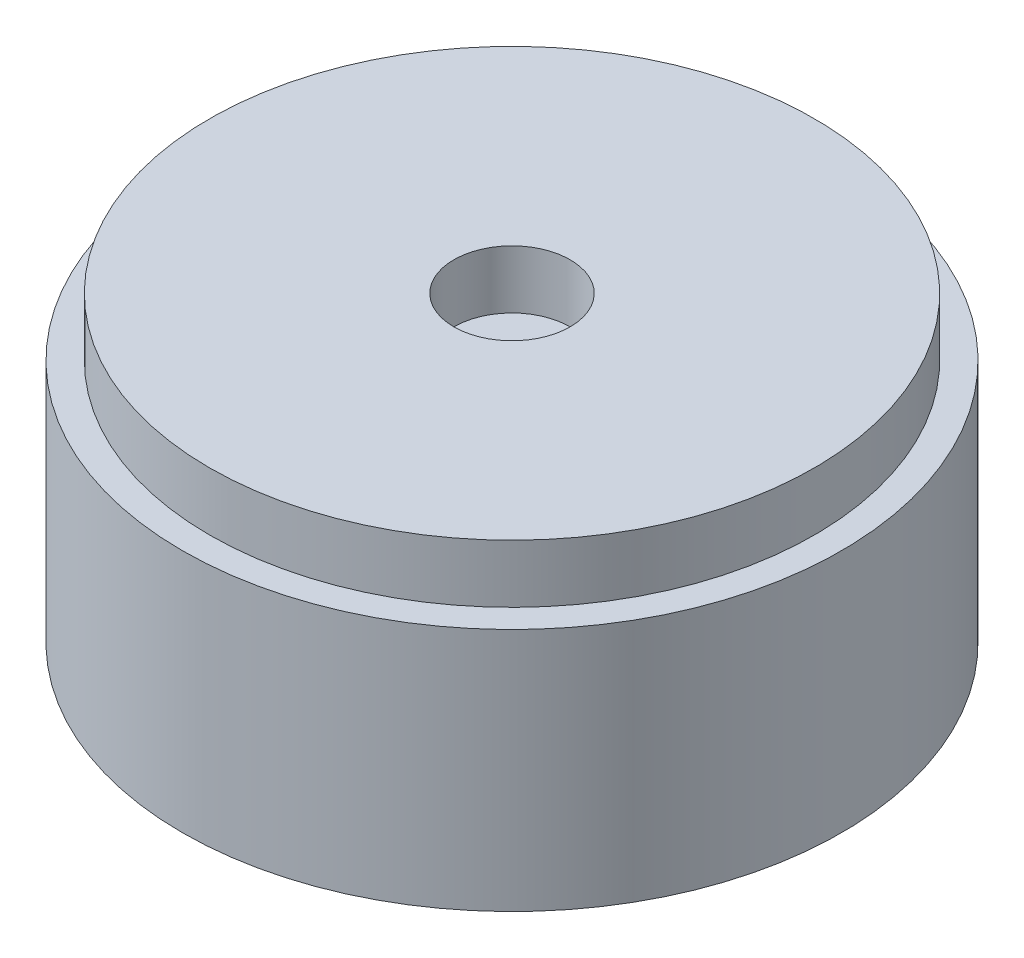
from build123d import *
from OCP.BRepFilletAPI import BRepFilletAPI_MakeChamfer

# Parameters (mm, degrees)
SKETCH1_R           = 8.5
BOSS_EXTRUDE1_DEPTH = 7.8
CUT_EXTRUDE1_START  = -1.5
SKETCH2_R           = 8.5
SKETCH2_R_2         = 7.8
SKETCH2_R_3         = 1.5
CUT_EXTRUDE1_DEPTH  = 1.5
SKETCH3_R           = 0.5
BOSS_EXTRUDE2_DEPTH = 2
CHAMFER1_SIZE       = 0.5
CHAMFER1_SIZE2      = 0.1
FILLET1_R           = 1


with BuildPart() as part:
    # Sketch1 → Boss-Extrude1 (new body)
    with BuildSketch(Plane(origin=(0, 0, 0), x_dir=(1, 0, 0), z_dir=(0, 1, 0))):
        with Locations(Location((0, 0, 0), (0, 0, 270))):
            Circle(SKETCH1_R)
    extrude(amount=BOSS_EXTRUDE1_DEPTH)

    # Sketch2 → Cut-Extrude1 (cut)
    # profile 1 of 2: a face of its own
    with BuildSketch(Plane(origin=(0, 7.8, 0), x_dir=(1, 0, 0), z_dir=(0, 1, 0)).offset(CUT_EXTRUDE1_START)):
        with Locations(Location((0, 0, 0), (0, 0, 270))):
            Circle(SKETCH2_R)
        with Locations(Location((0, 0, 0), (0, 0, 270))):
            Circle(SKETCH2_R_2, mode=Mode.SUBTRACT)
    # profile 2 of 2: a face of its own
    with BuildSketch(Plane(origin=(0, 7.8, 0), x_dir=(1, 0, 0), z_dir=(0, 1, 0)).offset(CUT_EXTRUDE1_START)):
        with Locations(Location((0, 0, 0), (0, 0, 270))):
            Circle(SKETCH2_R_3)
    extrude(amount=CUT_EXTRUDE1_DEPTH, mode=Mode.SUBTRACT)

    # Sketch3 → Boss-Extrude2 (add)
    with BuildSketch(Plane.XZ):
        with Locations(Location((-5, 5, 0), (0, 0, 90))):
            Circle(SKETCH3_R)
        with Locations(Location((5, -5, 0), (0, 0, 90))):
            Circle(SKETCH3_R)
    extrude(amount=BOSS_EXTRUDE2_DEPTH)

    # Chamfer1: one chamfer whose edges measure the first distance from different faces: ONE call of the kernel's chamfer builder (chamfer() names one face for all edges)
    chamfer1_edges_1 = [part.edges().sort_by_distance(p)[0] for p in [
        (-5, -2, 4.5),
    ]]
    chamfer1_side_1 = [part.faces().sort_by_distance(p)[0] for p in [
        (-5, -1, 4.5),
    ]]
    chamfer1_edges_2 = [part.edges().sort_by_distance(p)[0] for p in [
        (5, -2, -5.5),
    ]]
    chamfer1_side_2 = [part.faces().sort_by_distance(p)[0] for p in [
        (5, -1, -5.5),
    ]]
    chamfer1 = BRepFilletAPI_MakeChamfer(part.part.solid().wrapped)
    for e in chamfer1_edges_1:
        chamfer1.Add(CHAMFER1_SIZE, CHAMFER1_SIZE2, e.wrapped, chamfer1_side_1[0].wrapped)  # the first distance lies on this face
    for e in chamfer1_edges_2:
        chamfer1.Add(CHAMFER1_SIZE, CHAMFER1_SIZE2, e.wrapped, chamfer1_side_2[0].wrapped)  # the first distance lies on this face
    add(Compound.cast(chamfer1.Shape()), mode=Mode.REPLACE)

    # Fillet1
    fillet1_edges = [part.edges().sort_by_distance(p)[0] for p in [
        (-5, -1.5, 4.5),
        (5, -1.5, -5.5),
    ]]
    fillet(fillet1_edges, radius=FILLET1_R)


solid = part.part
